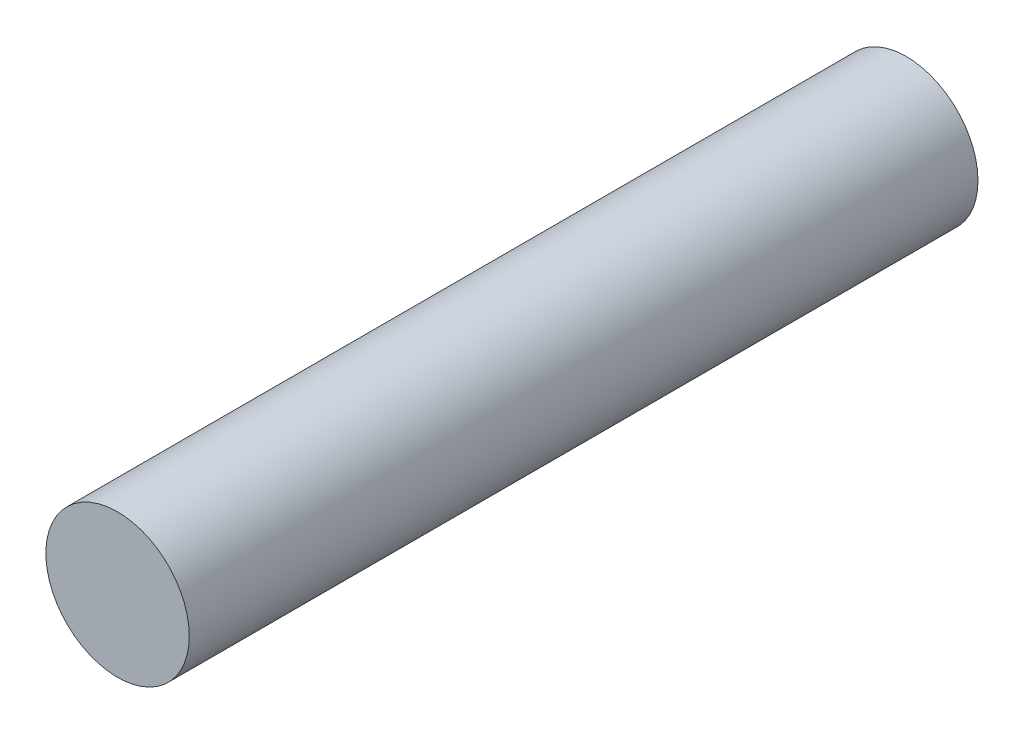
from build123d import *

# Parameters (mm, degrees)
SKETCH3_R           = 5
BOSS_EXTRUDE1_DEPTH = 55


with BuildPart() as part:
    # Sketch3 → Boss-Extrude1 (new body)
    with BuildSketch(Plane.XY):
        with Locations((-4.068667356, 4.068667356)):
            Circle(SKETCH3_R)
    extrude(amount=BOSS_EXTRUDE1_DEPTH)


solid = part.part
